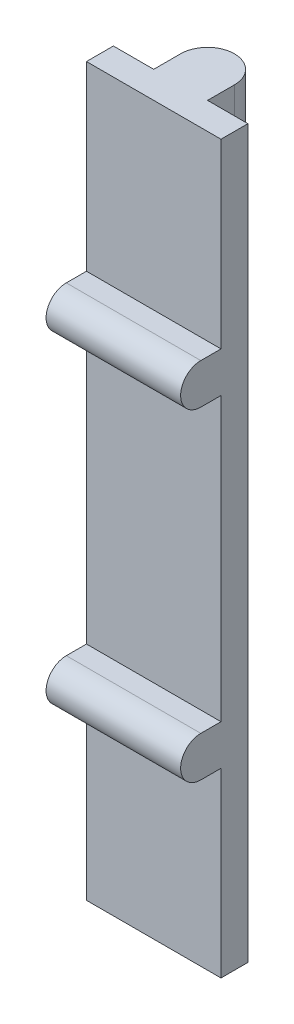
from build123d import *

# Parameters (mm, degrees)
SKETCH1_W           = 127
SKETCH1_H           = 685.8
BOSS_EXTRUDE1_DEPTH = 25.4
BOSS_EXTRUDE2_DEPTH = 127
BOSS_EXTRUDE3_DEPTH = 685.8


with BuildPart() as part:
    # Sketch1 → Boss-Extrude1 (new body)
    with BuildSketch(Plane.XY):
        with Locations((-63.5, 342.9)):
            Rectangle(SKETCH1_W, SKETCH1_H)
    extrude(amount=BOSS_EXTRUDE1_DEPTH)

    # Sketch2 → Boss-Extrude2 (add)
    with BuildSketch(Plane.ZY.offset(127)):
        with BuildLine():
            Line((44.45, 514.35), (25.4, 514.35))
            Line((25.4, 514.35), (25.4, 476.25))
            Line((25.4, 476.25), (44.45, 476.25))
            ThreePointArc((44.45, 476.25), (63.5, 495.3), (44.45, 514.35))
        make_face()
        with BuildLine():
            Line((44.45, 209.55), (25.4, 209.55))
            Line((25.4, 209.55), (25.4, 171.45))
            Line((25.4, 171.45), (44.45, 171.45))
            ThreePointArc((44.45, 171.45), (63.5, 190.5), (44.45, 209.55))
        make_face()
    extrude(amount=-BOSS_EXTRUDE2_DEPTH)

    # Sketch3 → Boss-Extrude3 (add)
    with BuildSketch(Plane.XZ):
        with BuildLine():
            Line((-88.9, -25.4), (-88.9, 0))
            Line((-88.9, 0), (-38.1, 0))
            Line((-38.1, 0), (-38.1, -25.4))
            ThreePointArc((-38.1, -25.4), (-63.5, -50.8), (-88.9, -25.4))
        make_face()
    extrude(amount=-BOSS_EXTRUDE3_DEPTH)


solid = part.part
